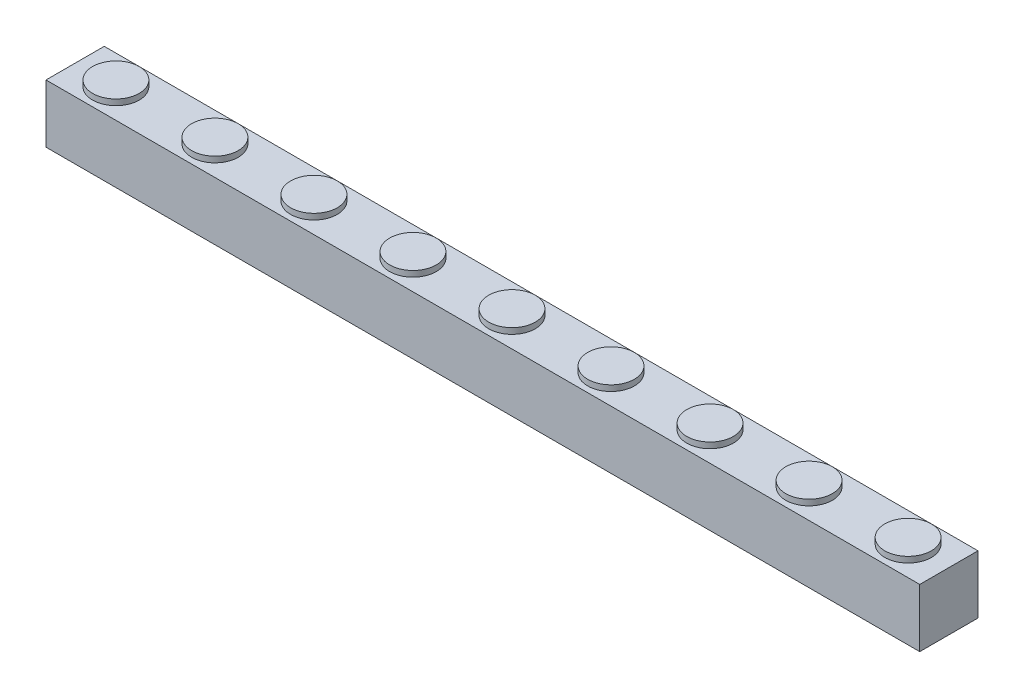
from build123d import *

# Parameters (mm, degrees)
SKETCH1_W           = 150
SKETCH1_H           = 10
BOSS_EXTRUDE1_DEPTH = 10
SKETCH2_R           = 4
BOSS_EXTRUDE2_DEPTH = 1


with BuildPart() as part:
    # Sketch1 → Boss-Extrude1 (new body)
    with BuildSketch(Plane(origin=(0, 0, 0), x_dir=(1, 0, 0), z_dir=(0, 1, 0))):
        Rectangle(SKETCH1_W, SKETCH1_H)
    extrude(amount=BOSS_EXTRUDE1_DEPTH)

    # Sketch2 → Boss-Extrude2 (add)
    with BuildSketch(Plane(origin=(0, 10, 0), x_dir=(1, 0, 0), z_dir=(0, 1, 0))):
        with Locations(Location((0, 0, 0), (0, 0, 90))):
            Circle(SKETCH2_R)
        with Locations(Location((17, 0, 0), (0, 0, 90))):
            Circle(SKETCH2_R)
        with Locations(Location((34, 0, 0), (0, 0, 90))):
            Circle(SKETCH2_R)
        with Locations(Location((51, 0, 0), (0, 0, 90))):
            Circle(SKETCH2_R)
        with Locations(Location((68, 0, 0), (0, 0, 90))):
            Circle(SKETCH2_R)
        with Locations(Location((-17, 0, 0), (0, 0, 90))):
            Circle(SKETCH2_R)
        with Locations(Location((-34, 0, 0), (0, 0, 90))):
            Circle(SKETCH2_R)
        with Locations(Location((-51, 0, 0), (0, 0, 90))):
            Circle(SKETCH2_R)
        with Locations(Location((-68, 0, 0), (0, 0, 90))):
            Circle(SKETCH2_R)
    extrude(amount=BOSS_EXTRUDE2_DEPTH)


solid = part.part
